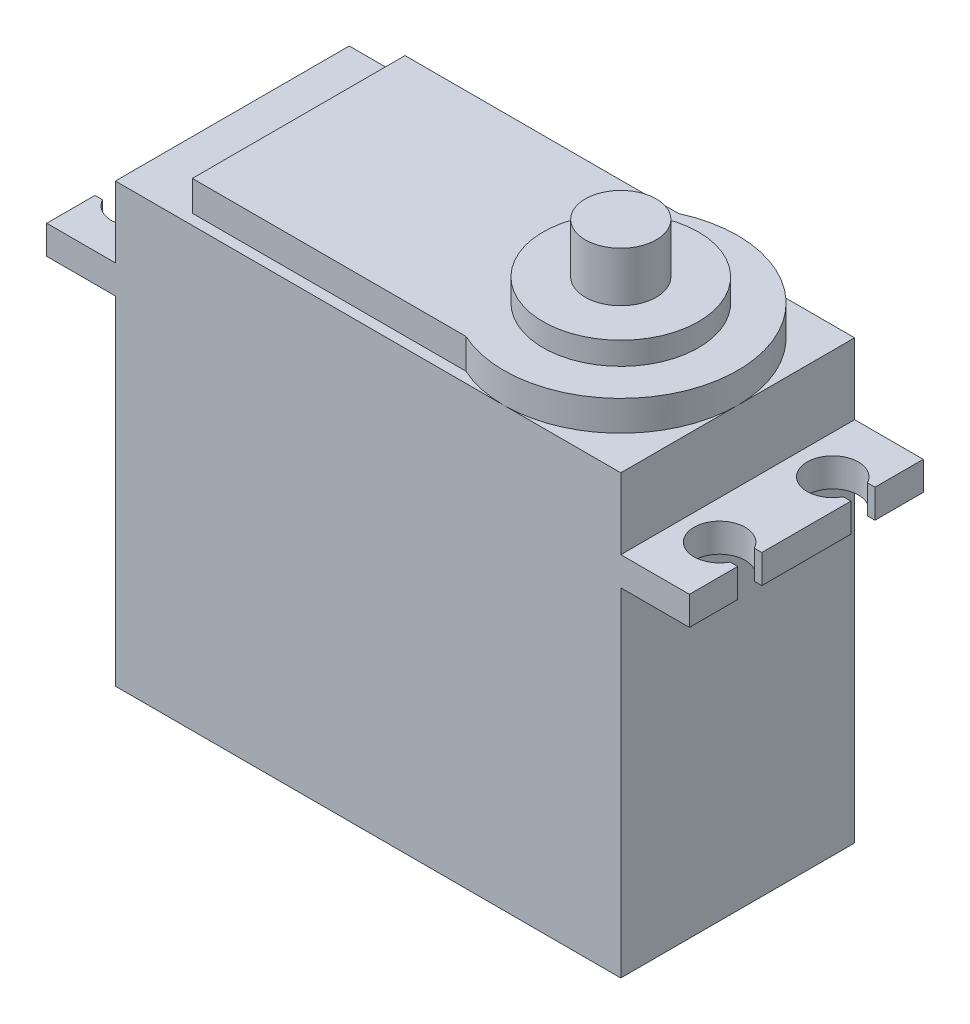
from build123d import *

# Parameters (mm, degrees)
BOSS_EXTRUDE1_DEPTH      = 2.413
BOSS_EXTRUDE2_DEPTH      = 8.382
BOSS_EXTRUDE2_DEPTH_BACK = 28.448
SKETCH3_W                = 42.545
SKETCH3_H                = 19.685
BOSS_EXTRUDE3_DEPTH      = 2.54
SKETCH5_R                = 6.5405
BOSS_EXTRUDE4_DEPTH      = 1.905
SKETCH6_R                = 2.9845
BOSS_EXTRUDE5_DEPTH      = 4.191


with BuildPart() as part:
    # Sketch2 → Boss-Extrude1 (new body)
    with BuildSketch(Plane(origin=(0, 0, 0), x_dir=(1, 0, 0), z_dir=(0, 1, 0))):
        with BuildLine():
            Line((-27.051, -9.8425), (27.051, -9.8425))
            Line((27.051, -9.8425), (27.051, -5.7785))
            Line((27.051, -5.7785), (26.416, -5.7785))
            ThreePointArc((26.416, -5.7785), (22.352, -4.7625), (26.416, -3.7465))
            Line((26.416, -3.7465), (27.051, -3.7465))
            Line((27.051, -3.7465), (27.051, 3.7465))
            Line((27.051, 3.7465), (26.416, 3.7465))
            ThreePointArc((26.416, 3.7465), (22.352, 4.7625), (26.416, 5.7785))
            Line((26.416, 5.7785), (27.051, 5.7785))
            Line((27.051, 5.7785), (27.051, 9.8425))
            Line((27.051, 9.8425), (-27.051, 9.8425))
            Line((-27.051, 9.8425), (-27.051, 5.7785))
            Line((-27.051, 5.7785), (-26.416, 5.7785))
            ThreePointArc((-26.416, 5.7785), (-22.352, 4.7625), (-26.416, 3.7465))
            Line((-26.416, 3.7465), (-27.051, 3.7465))
            Line((-27.051, 3.7465), (-27.051, -3.7465))
            Line((-27.051, -3.7465), (-26.416, -3.7465))
            ThreePointArc((-26.416, -3.7465), (-22.352, -4.7625), (-26.416, -5.7785))
            Line((-26.416, -5.7785), (-27.051, -5.7785))
            Line((-27.051, -5.7785), (-27.051, -9.8425))
        make_face()
    extrude(amount=BOSS_EXTRUDE1_DEPTH)

    # Sketch3 → Boss-Extrude2 (add, two sides: drawn at the far end of the back side and taken through both)
    with BuildSketch(Plane(origin=(0, 0, 0), x_dir=(1, 0, 0), z_dir=(0, 1, 0)).offset(-BOSS_EXTRUDE2_DEPTH_BACK)):
        Rectangle(SKETCH3_W, SKETCH3_H)
    extrude(amount=BOSS_EXTRUDE2_DEPTH + BOSS_EXTRUDE2_DEPTH_BACK)

    # Sketch4 → Boss-Extrude3 (add)
    with BuildSketch(Plane(origin=(0, 8.382, 0), x_dir=(1, 0, 0), z_dir=(0, 1, 0))):
        with BuildLine():
            Line((-15.6845, 8.9535), (7.342256857, 8.9535))
            ThreePointArc((7.342256857, 8.9535), (21.2725, 0), (7.342256857, -8.9535))
            Line((7.342256857, -8.9535), (-15.6845, -8.9535))
            Line((-15.6845, -8.9535), (-15.6845, 8.9535))
        make_face()
    extrude(amount=BOSS_EXTRUDE3_DEPTH)

    # Sketch5 → Boss-Extrude4 (add)
    with BuildSketch(Plane(origin=(0, 10.922, 0), x_dir=(1, 0, 0), z_dir=(0, 1, 0))):
        with Locations(Location((11.43, 0, 0), (0, 0, 90))):
            Circle(SKETCH5_R)
    extrude(amount=BOSS_EXTRUDE4_DEPTH)

    # Sketch6 → Boss-Extrude5 (add)
    with BuildSketch(Plane(origin=(0, 12.827, 0), x_dir=(1, 0, 0), z_dir=(0, 1, 0))):
        with Locations(Location((11.43, 0, 0), (0, 0, 270))):
            Circle(SKETCH6_R)
    extrude(amount=BOSS_EXTRUDE5_DEPTH)


solid = part.part
